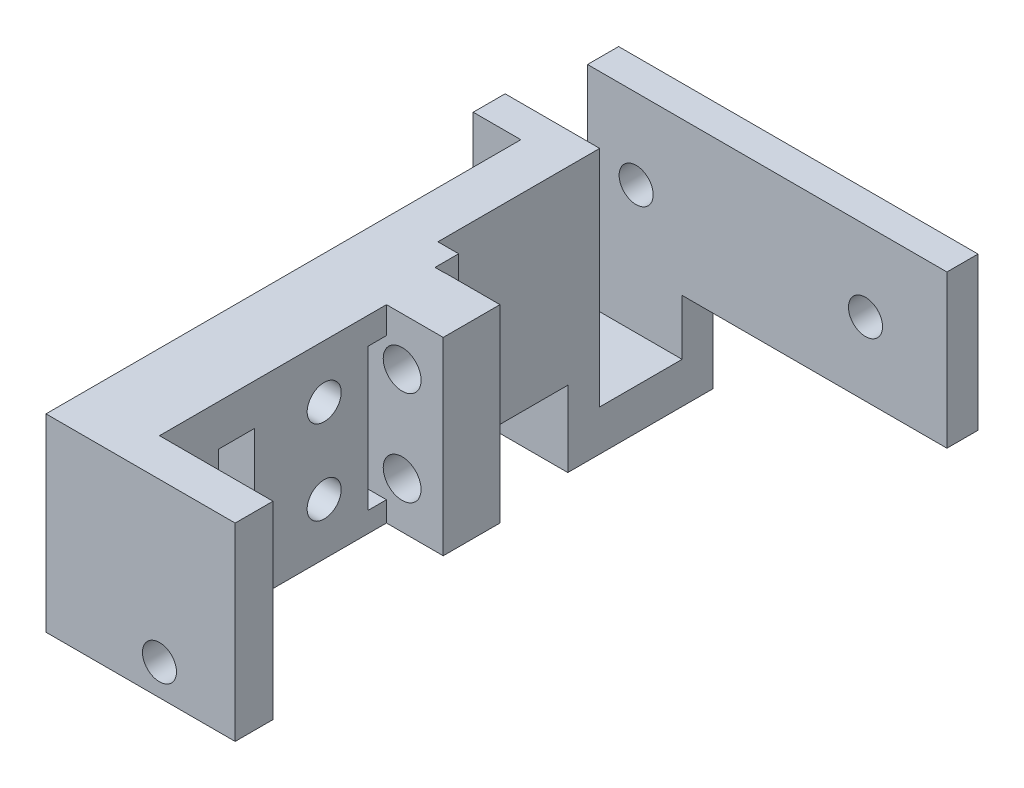
from build123d import *

# Parameters (mm, degrees)
SKETCH1_W                = 8
SKETCH1_H                = 24
SKETCH1_H_2              = 6
SKETCH1_H_3              = 26.58
SKETCH1_W_2              = 6
BOSS_EXTRUDE1_DEPTH      = 20
SKETCH2_W                = 0.38984803
SKETCH2_H                = 24.105830214
CUT_EXTRUDE1_DEPTH       = 20
SKETCH3_W                = 42.504801082
SKETCH3_H                = 61.271071749
CUT_EXTRUDE2_DEPTH       = 7
BOSS_EXTRUDE3_DEPTH      = 8
BOSS_EXTRUDE3_DEPTH_BACK = 20
SKETCH5_W                = 10
SKETCH5_H                = 3.373015501
SKETCH6_R                = 2
CUT_EXTRUDE3_DEPTH       = 6
SKETCH7_W                = 10
SKETCH7_H                = 4.325701587
BOSS_EXTRUDE4_DEPTH      = 12
SKETCH8_W                = 10
SKETCH8_H                = 3.285099304
BOSS_EXTRUDE5_DEPTH      = 22
SKETCH9_R                = 1.8
CUT_EXTRUDE4_DEPTH       = 20
SKETCH10_W               = 4.6581603
SKETCH10_H               = 5.7
CUT_EXTRUDE5_DEPTH       = 3
SKETCH12_R               = 1.8
CUT_EXTRUDE7_DEPTH       = 5
SKETCH13_R               = 1.8
CUT_EXTRUDE8_DEPTH       = 12
SKETCH14_W               = 3.285099304
SKETCH14_H               = 16.14069385
BOSS_EXTRUDE6_DEPTH      = 28
SKETCH15_R               = 1.8
CUT_EXTRUDE9_DEPTH       = 20
SKETCH16_W               = 1.97268601
SKETCH16_H               = 15.028302634
CUT_EXTRUDE10_DEPTH      = 2
SKETCH18_W               = 3.824807143
SKETCH18_H               = 10.692395384
CUT_EXTRUDE11_DEPTH      = 10


with BuildPart() as part:
    # Sketch1 → Boss-Extrude1 (new body)
    with BuildSketch(Plane(origin=(0, 0, 0), x_dir=(1, 0, 0), z_dir=(0, 1, 0))):
        with Locations((4, -44.58)):
            Rectangle(SKETCH1_W, SKETCH1_H)
        with Locations((4, -29.58)):
            Rectangle(SKETCH1_W, SKETCH1_H_2)
        with Locations((4, -13.29)):
            Rectangle(SKETCH1_W, SKETCH1_H_3)
        with Locations((11, -29.58)):
            Rectangle(SKETCH1_W_2, SKETCH1_H_2)
        Polygon((8, -56.58), (0, -56.58), (0, -60.58), (20, -60.58), (20, -56.58), align=None)
    extrude(amount=BOSS_EXTRUDE1_DEPTH)

    # Sketch2 → Cut-Extrude1 (cut)
    with BuildSketch(Plane(origin=(0, 0, 0), x_dir=(-1, 0, 0), z_dir=(0, -1, 0))):
        Polygon((-7.155800491, -26.605830214), (-7.155800491, -24.105830214), (-8, -24.105830214), (-8, -26.58), (-8.155800491, -26.58), (-8.155800491, -26.605830214), align=None)
        Polygon((-8, -24.105830214), (-7.155800491, -24.105830214), (-5.353625866, -24.105830214), (-5.353625866, 0), (-8, 0), align=None)
        with Locations((-5.158701851, -12.052915107)):
            Rectangle(SKETCH2_W, SKETCH2_H)
    extrude(amount=-CUT_EXTRUDE1_DEPTH, mode=Mode.SUBTRACT)

    # Sketch3 → Cut-Extrude2 (cut)
    with BuildSketch(Plane(origin=(0, 0, 0), x_dir=(-1, 0, 0), z_dir=(0, 0, -1))):
        with Locations((-1.640387793, 8.242348963)):
            Rectangle(SKETCH3_W, SKETCH3_H)
    extrude(amount=-CUT_EXTRUDE2_DEPTH, mode=Mode.SUBTRACT)

    # Sketch5 → Boss-Extrude3 (add, two sides: drawn at the far end of the back side and taken through both)
    with BuildSketch(Plane(origin=(0, 0, 0), x_dir=(-1, 0, 0), z_dir=(0, -1, 0)).offset(-BOSS_EXTRUDE3_DEPTH_BACK)):
        with Locations((0.036222164, -8.686507751)):
            Rectangle(SKETCH5_W, SKETCH5_H)
    extrude(amount=BOSS_EXTRUDE3_DEPTH + BOSS_EXTRUDE3_DEPTH_BACK)

    # Sketch6 → Cut-Extrude3 (cut)
    with BuildSketch(Plane(origin=(0, 0, 26.58), x_dir=(-1, 0, 0), z_dir=(0, 0, -1))):
        with Locations(Location((-9.655800491, 4.904630263, 0), (0, 0, 34.116357222))):
            Circle(SKETCH6_R)
        with Locations(Location((-9.655800491, 14.904630263, 0), (0, 0, 325.883642778))):
            Circle(SKETCH6_R)
    extrude(amount=-CUT_EXTRUDE3_DEPTH, mode=Mode.SUBTRACT)

    # Sketch7 → Boss-Extrude4 (add)
    with BuildSketch(Plane(origin=(0, 0, 7), x_dir=(-1, 0, 0), z_dir=(0, 0, -1))):
        with Locations((0.036222164, -5.837149207)):
            Rectangle(SKETCH7_W, SKETCH7_H)
    extrude(amount=BOSS_EXTRUDE4_DEPTH)

    # Sketch8 → Boss-Extrude5 (add)
    with BuildSketch(Plane(origin=(0, -3.674298413, 0), x_dir=(1, 0, 0), z_dir=(0, 1, 0))):
        with Locations((-0.036222164, 3.357450348)):
            Rectangle(SKETCH8_W, SKETCH8_H)
    extrude(amount=BOSS_EXTRUDE5_DEPTH)

    # Sketch9 → Cut-Extrude4 (cut)
    with BuildSketch(Plane(origin=(0, 0, -5), x_dir=(-1, 0, 0), z_dir=(0, 0, -1))):
        with Locations((-0.102745826, 9.860584284)):
            Circle(SKETCH9_R)
    extrude(amount=-CUT_EXTRUDE4_DEPTH, mode=Mode.SUBTRACT)

    # Sketch10 → Cut-Extrude5 (cut)
    with BuildSketch(Plane.ZY):
        with Locations((12.702095651, 9.85)):
            Rectangle(SKETCH10_W, SKETCH10_H)
    extrude(amount=-CUT_EXTRUDE5_DEPTH, mode=Mode.SUBTRACT)

    # Sketch12 → Cut-Extrude7 (cut)
    with BuildSketch(Plane.XY.offset(60.58)):
        with Locations((12, 3.26546718)):
            Circle(SKETCH12_R)
    extrude(amount=-CUT_EXTRUDE7_DEPTH, mode=Mode.SUBTRACT)

    # Sketch13 → Cut-Extrude8 (cut)
    with BuildSketch(Plane.ZY):
        with Locations((39.167156573, 5.468808009)):
            Circle(SKETCH13_R)
        with Locations((39.167156573, 14.370824603)):
            Circle(SKETCH13_R)
    extrude(amount=-CUT_EXTRUDE8_DEPTH, mode=Mode.SUBTRACT)

    # Sketch14 → Boss-Extrude6 (add)
    with BuildSketch(Plane(origin=(4.963777836, 0, 0), x_dir=(0, 0, -1), z_dir=(1, 0, 0))):
        with Locations((3.357450348, 10.255354662)):
            Rectangle(SKETCH14_W, SKETCH14_H)
    extrude(amount=BOSS_EXTRUDE6_DEPTH)

    # Sketch15 → Cut-Extrude9 (cut)
    with BuildSketch(Plane(origin=(0, 0, -5), x_dir=(-1, 0, 0), z_dir=(0, 0, -1))):
        with Locations((-24.353207193, 9.904630263)):
            Circle(SKETCH15_R)
    extrude(amount=-CUT_EXTRUDE9_DEPTH, mode=Mode.SUBTRACT)

    # Sketch16 → Cut-Extrude10 (cut)
    with BuildSketch(Plane(origin=(8, 0, 0), x_dir=(0, 0, -1), z_dir=(1, 0, 0))):
        with Locations((-33.566343005, 9.65070179)):
            Rectangle(SKETCH16_W, SKETCH16_H)
    extrude(amount=-CUT_EXTRUDE10_DEPTH, mode=Mode.SUBTRACT)

    # Sketch18 → Cut-Extrude11 (cut)
    with BuildSketch(Plane.ZY):
        with Locations((48.45250386, 10.297450391)):
            Rectangle(SKETCH18_W, SKETCH18_H)
    extrude(amount=-CUT_EXTRUDE11_DEPTH, mode=Mode.SUBTRACT)


solid = part.part
